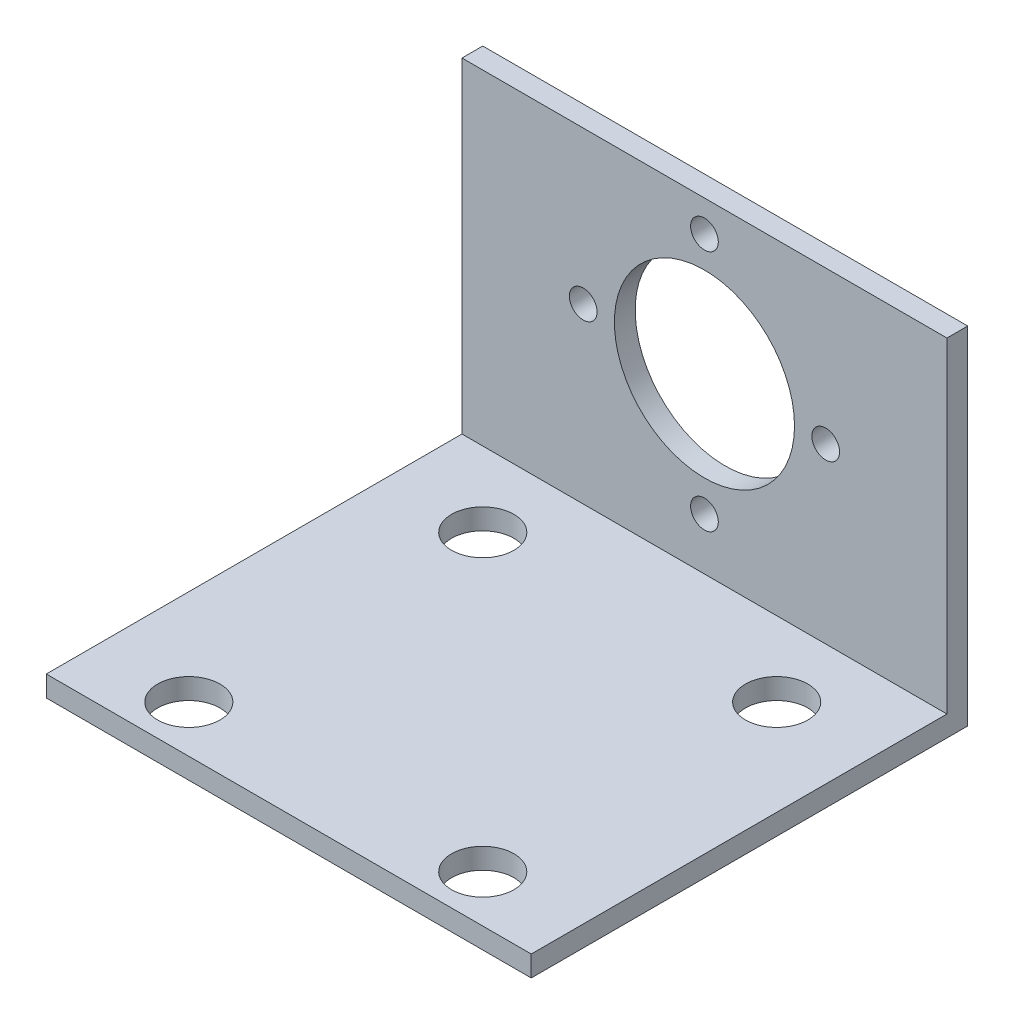
from build123d import *

# Parameters (mm, degrees)
SKETCH_1_R          = 13
SKETCH_1_R_2        = 2
EXTRUDE_1_DEPTH     = 3
SKETCH_2_W          = 70
SKETCH_2_H          = 3
EXTRUDE_2_DEPTH     = 60
SKETCH_3_R          = 4.5
CUT_EXTRUDE_1_DEPTH = 87.040688049


with BuildPart() as part:
    # 草图1 → 凸台-拉伸1 (new body)
    with BuildSketch(Plane.XY):
        Polygon((-35, 22), (35, 22), (35, -28), (-35, -28), (-35, 0), align=None)
        Circle(SKETCH_1_R, mode=Mode.SUBTRACT)
        with Locations((0, 17.5)):
            Circle(SKETCH_1_R_2, mode=Mode.SUBTRACT)
        with Locations((17.5, 0)):
            Circle(SKETCH_1_R_2, mode=Mode.SUBTRACT)
        with Locations((0, -17.5)):
            Circle(SKETCH_1_R_2, mode=Mode.SUBTRACT)
        with Locations((-17.5, 0)):
            Circle(SKETCH_1_R_2, mode=Mode.SUBTRACT)
    extrude(amount=EXTRUDE_1_DEPTH)

    # 草图2 → 凸台-拉伸2 (add)
    with BuildSketch(Plane.XY.offset(3)):
        with Locations((0, -26.5)):
            Rectangle(SKETCH_2_W, SKETCH_2_H)
    extrude(amount=EXTRUDE_2_DEPTH)

    # 草图3 → 切除-拉伸1 (cut, through all)
    with BuildSketch(Plane(origin=(0, -25, 0), x_dir=(1, 0, 0), z_dir=(0, 1, 0))):
        with Locations(Location((21.213203436, -13.786796564, 0), (0, 0, 270))):
            Circle(SKETCH_3_R)
        with Locations(Location((21.213203436, -56.213203436, 0), (0, 0, 270))):
            Circle(SKETCH_3_R)
        with Locations(Location((-21.213203436, -56.213203436, 0), (0, 0, 270))):
            Circle(SKETCH_3_R)
        with Locations(Location((-21.213203436, -13.786796564, 0), (0, 0, 270))):
            Circle(SKETCH_3_R)
    extrude(amount=-CUT_EXTRUDE_1_DEPTH, mode=Mode.SUBTRACT)


solid = part.part
